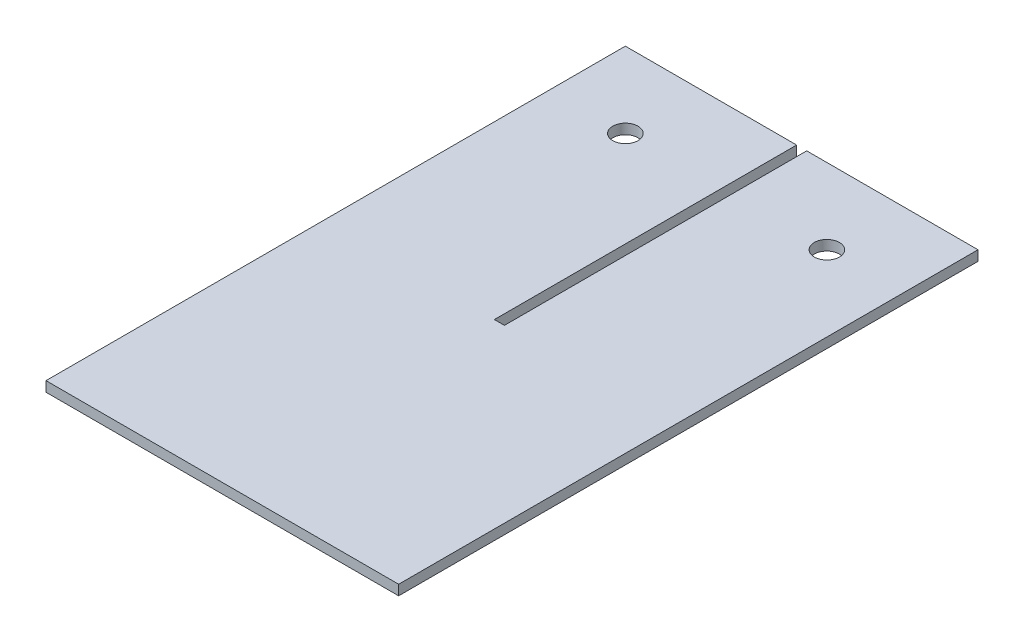
from build123d import *

# Parameters (mm, degrees)
SKETCH1_R           = 2.5
BOSS_EXTRUDE1_DEPTH = 2


with BuildPart() as part:
    # Sketch1 → Boss-Extrude1 (new body)
    with BuildSketch(Plane(origin=(0, 0, 0), x_dir=(1, 0, 0), z_dir=(0, 1, 0))):
        Polygon((1, 57.5), (35, 57.5), (35, -57.5), (-35, -57.5), (-35, 57.5), (-1, 57.5), (-1, -2.5), (1, -2.5), align=None)
        with Locations(Location((-20, 42.5, 0), (0, 0, 270))):
            Circle(SKETCH1_R, mode=Mode.SUBTRACT)
        with Locations(Location((20, 42.5, 0), (0, 0, 270))):
            Circle(SKETCH1_R, mode=Mode.SUBTRACT)
    extrude(amount=BOSS_EXTRUDE1_DEPTH)


solid = part.part
